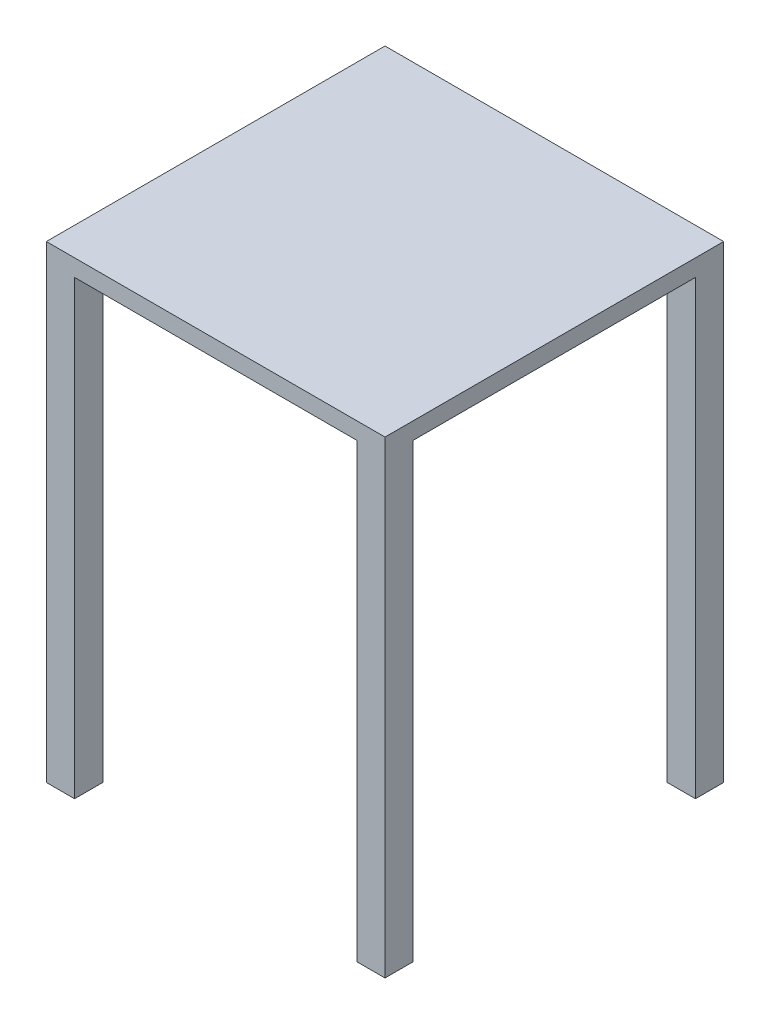
from build123d import *

# Parameters (mm, degrees)
SKETCH_1_W      = 600
SKETCH_1_H      = 600
EXTRUDE_1_DEPTH = 30
SKETCH_2_W      = 50
SKETCH_2_H      = 50
EXTRUDE_2_DEPTH = 800


with BuildPart() as part:
    # 草图1 → 凸台-拉伸1 (new body)
    with BuildSketch(Plane(origin=(0, 0, 0), x_dir=(1, 0, 0), z_dir=(0, 1, 0))):
        Rectangle(SKETCH_1_W, SKETCH_1_H)
    extrude(amount=EXTRUDE_1_DEPTH)

    # 草图2 → 凸台-拉伸2 (add)
    with BuildSketch(Plane.XZ):
        with Locations((-275, 275)):
            Rectangle(SKETCH_2_W, SKETCH_2_H)
        with Locations((275, 275)):
            Rectangle(SKETCH_2_W, SKETCH_2_H)
        with Locations((275, -275)):
            Rectangle(SKETCH_2_W, SKETCH_2_H)
        with Locations((-275, -275)):
            Rectangle(SKETCH_2_W, SKETCH_2_H)
    extrude(amount=EXTRUDE_2_DEPTH)


solid = part.part
